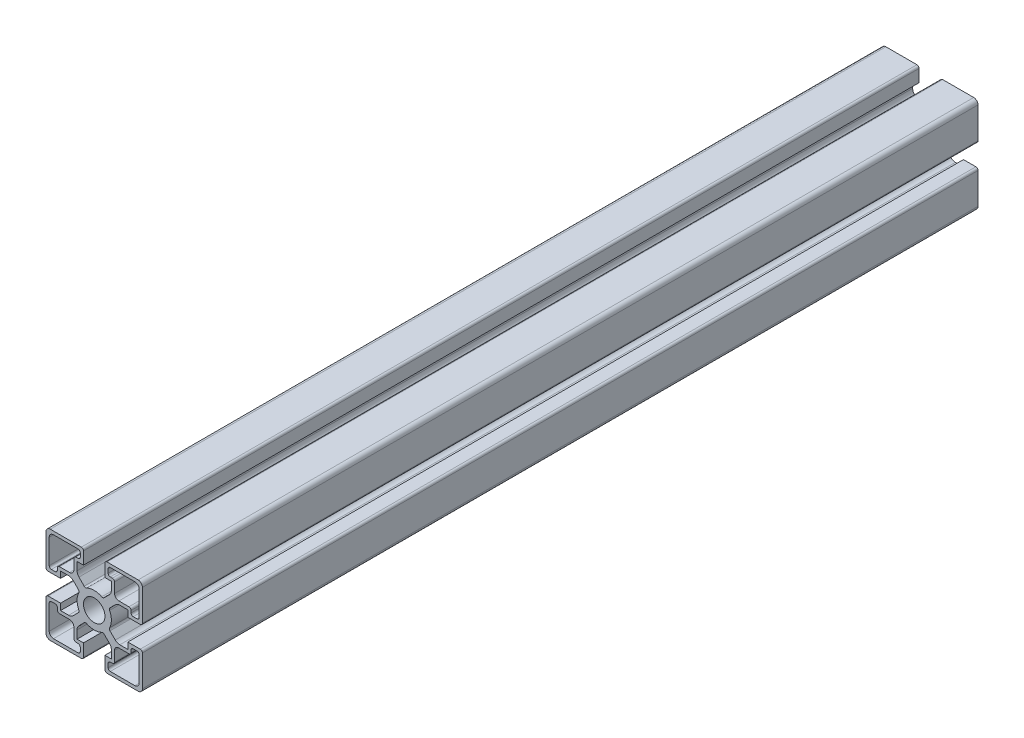
from build123d import *

# Parameters (mm, degrees)
SKETCH1_R           = 5
BOSS_EXTRUDE1_DEPTH = 390


with BuildPart() as part:
    # Sketch1 → Boss-Extrude1 (new body)
    with BuildSketch(Plane.XY):
        with BuildLine():
            Line((-5, -15.705854984), (-8, -15.705854984))
            Line((-8, -15.705854984), (-8, -11.948495671))
            ThreePointArc((-8, -11.948495671), (-7.771638598, -10.800445374), (-7.121320344, -9.827175327))
            Line((-7.121320344, -9.827175327), (-4.66838954, -7.374244523))
            ThreePointArc((-4.66838954, -7.374244523), (-4.125357909, -7.094903463), (-3.52114023, -7.183423382))
            ThreePointArc((-3.52114023, -7.183423382), (0, -8), (3.52114023, -7.183423382))
            ThreePointArc((3.52114023, -7.183423382), (4.125357909, -7.094903463), (4.66838954, -7.374244523))
            Line((4.66838954, -7.374244523), (7.121320344, -9.827175327))
            ThreePointArc((7.121320344, -9.827175327), (7.771638598, -10.800445374), (8, -11.948495671))
            Line((8, -11.948495671), (8, -15.705854984))
            Line((8, -15.705854984), (5, -15.705854984))
            Line((5, -15.705854984), (5, -21.5))
            ThreePointArc((5, -21.5), (5.292893219, -22.207106781), (6, -22.5))
            Line((6, -22.5), (20.5, -22.5))
            ThreePointArc((20.5, -22.5), (21.914213562, -21.914213562), (22.5, -20.5))
            Line((22.5, -20.5), (22.5, -6))
            ThreePointArc((22.5, -6), (22.207106781, -5.292893219), (21.5, -5))
            Line((21.5, -5), (15.705854984, -5))
            Line((15.705854984, -5), (15.705854984, -8))
            Line((15.705854984, -8), (11.948495671, -8))
            ThreePointArc((11.948495671, -8), (10.800445374, -7.771638598), (9.827175327, -7.121320344))
            Line((9.827175327, -7.121320344), (7.374244523, -4.66838954))
            ThreePointArc((7.374244523, -4.66838954), (7.094903463, -4.125357909), (7.183423382, -3.52114023))
            ThreePointArc((7.183423382, -3.52114023), (8, 0), (7.183423382, 3.52114023))
            ThreePointArc((7.183423382, 3.52114023), (7.094903463, 4.125357909), (7.374244523, 4.66838954))
            Line((7.374244523, 4.66838954), (9.827175327, 7.121320344))
            ThreePointArc((9.827175327, 7.121320344), (10.800445374, 7.771638598), (11.948495671, 8))
            Line((11.948495671, 8), (15.705854984, 8))
            Line((15.705854984, 8), (15.705854984, 5))
            Line((15.705854984, 5), (21.5, 5))
            ThreePointArc((21.5, 5), (22.207106781, 5.292893219), (22.5, 6))
            Line((22.5, 6), (22.5, 20.5))
            ThreePointArc((22.5, 20.5), (21.914213562, 21.914213562), (20.5, 22.5))
            Line((20.5, 22.5), (6, 22.5))
            ThreePointArc((6, 22.5), (5.292893219, 22.207106781), (5, 21.5))
            Line((5, 21.5), (5, 15.705854984))
            Line((5, 15.705854984), (8, 15.705854984))
            Line((8, 15.705854984), (8, 11.948495671))
            ThreePointArc((8, 11.948495671), (7.771638598, 10.800445374), (7.121320344, 9.827175327))
            Line((7.121320344, 9.827175327), (4.66838954, 7.374244523))
            ThreePointArc((4.66838954, 7.374244523), (4.125357909, 7.094903463), (3.52114023, 7.183423382))
            ThreePointArc((3.52114023, 7.183423382), (0, 8), (-3.52114023, 7.183423382))
            ThreePointArc((-3.52114023, 7.183423382), (-4.125357909, 7.094903463), (-4.66838954, 7.374244523))
            Line((-4.66838954, 7.374244523), (-7.121320344, 9.827175327))
            ThreePointArc((-7.121320344, 9.827175327), (-7.771638598, 10.800445374), (-8, 11.948495671))
            Line((-8, 11.948495671), (-8, 15.705854984))
            Line((-8, 15.705854984), (-5, 15.705854984))
            Line((-5, 15.705854984), (-5, 21.5))
            ThreePointArc((-5, 21.5), (-5.292893219, 22.207106781), (-6, 22.5))
            Line((-6, 22.5), (-20.5, 22.5))
            ThreePointArc((-20.5, 22.5), (-21.914213562, 21.914213562), (-22.5, 20.5))
            Line((-22.5, 20.5), (-22.5, 6))
            ThreePointArc((-22.5, 6), (-22.207106781, 5.292893219), (-21.5, 5))
            Line((-21.5, 5), (-15.705854984, 5))
            Line((-15.705854984, 5), (-15.705854984, 8))
            Line((-15.705854984, 8), (-11.948495671, 8))
            ThreePointArc((-11.948495671, 8), (-10.800445374, 7.771638598), (-9.827175327, 7.121320344))
            Line((-9.827175327, 7.121320344), (-7.374244523, 4.66838954))
            ThreePointArc((-7.374244523, 4.66838954), (-7.094903463, 4.125357909), (-7.183423382, 3.52114023))
            ThreePointArc((-7.183423382, 3.52114023), (-8, 0), (-7.183423382, -3.52114023))
            ThreePointArc((-7.183423382, -3.52114023), (-7.094903463, -4.125357909), (-7.374244523, -4.66838954))
            Line((-7.374244523, -4.66838954), (-9.827175327, -7.121320344))
            ThreePointArc((-9.827175327, -7.121320344), (-10.800445374, -7.771638598), (-11.948495671, -8))
            Line((-11.948495671, -8), (-15.705854984, -8))
            Line((-15.705854984, -8), (-15.705854984, -5))
            Line((-15.705854984, -5), (-21.5, -5))
            ThreePointArc((-21.5, -5), (-22.207106781, -5.292893219), (-22.5, -6))
            Line((-22.5, -6), (-22.5, -20.5))
            ThreePointArc((-22.5, -20.5), (-21.914213562, -21.914213562), (-20.5, -22.5))
            Line((-20.5, -22.5), (-6, -22.5))
            ThreePointArc((-6, -22.5), (-5.292893219, -22.207106781), (-5, -21.5))
            Line((-5, -21.5), (-5, -15.705854984))
        make_face()
        Circle(SKETCH1_R, mode=Mode.SUBTRACT)
        with BuildLine():
            Line((-19, -21), (-7.5, -21))
            ThreePointArc((-7.5, -21), (-6.792893219, -20.707106781), (-6.5, -20))
            Line((-6.5, -20), (-6.5, -18.205854984))
            ThreePointArc((-6.5, -18.205854984), (-6.792893219, -17.498748202), (-7.5, -17.205854984))
            Line((-7.5, -17.205854984), (-8.5, -17.205854984))
            ThreePointArc((-8.5, -17.205854984), (-9.207106781, -16.912961765), (-9.5, -16.205854984))
            Line((-9.5, -16.205854984), (-9.5, -11.5))
            ThreePointArc((-9.5, -11.5), (-10.085786438, -10.085786438), (-11.5, -9.5))
            Line((-11.5, -9.5), (-16.205854984, -9.5))
            ThreePointArc((-16.205854984, -9.5), (-16.912961765, -9.207106781), (-17.205854984, -8.5))
            Line((-17.205854984, -8.5), (-17.205854984, -7.5))
            ThreePointArc((-17.205854984, -7.5), (-17.498748202, -6.792893219), (-18.205854984, -6.5))
            Line((-18.205854984, -6.5), (-20, -6.5))
            ThreePointArc((-20, -6.5), (-20.707106781, -6.792893219), (-21, -7.5))
            Line((-21, -7.5), (-21, -19))
            ThreePointArc((-21, -19), (-20.414213562, -20.414213562), (-19, -21))
        make_face(mode=Mode.SUBTRACT)
        with BuildLine():
            Line((-9.5, 16.205854984), (-9.5, 11.5))
            ThreePointArc((-9.5, 11.5), (-10.085786438, 10.085786438), (-11.5, 9.5))
            Line((-11.5, 9.5), (-16.205854984, 9.5))
            ThreePointArc((-16.205854984, 9.5), (-16.912961765, 9.207106781), (-17.205854984, 8.5))
            Line((-17.205854984, 8.5), (-17.205854984, 7.5))
            ThreePointArc((-17.205854984, 7.5), (-17.498748202, 6.792893219), (-18.205854984, 6.5))
            Line((-18.205854984, 6.5), (-20, 6.5))
            ThreePointArc((-20, 6.5), (-20.707106781, 6.792893219), (-21, 7.5))
            Line((-21, 7.5), (-21, 19))
            ThreePointArc((-21, 19), (-20.414213562, 20.414213562), (-19, 21))
            Line((-19, 21), (-7.5, 21))
            ThreePointArc((-7.5, 21), (-6.792893219, 20.707106781), (-6.5, 20))
            Line((-6.5, 20), (-6.5, 18.205854984))
            ThreePointArc((-6.5, 18.205854984), (-6.792893219, 17.498748202), (-7.5, 17.205854984))
            Line((-7.5, 17.205854984), (-8.5, 17.205854984))
            ThreePointArc((-8.5, 17.205854984), (-9.207106781, 16.912961765), (-9.5, 16.205854984))
        make_face(mode=Mode.SUBTRACT)
        with BuildLine():
            Line((16.205854984, 9.5), (11.5, 9.5))
            ThreePointArc((11.5, 9.5), (10.085786438, 10.085786438), (9.5, 11.5))
            Line((9.5, 11.5), (9.5, 16.205854984))
            ThreePointArc((9.5, 16.205854984), (9.207106781, 16.912961765), (8.5, 17.205854984))
            Line((8.5, 17.205854984), (7.5, 17.205854984))
            ThreePointArc((7.5, 17.205854984), (6.792893219, 17.498748202), (6.5, 18.205854984))
            Line((6.5, 18.205854984), (6.5, 20))
            ThreePointArc((6.5, 20), (6.792893219, 20.707106781), (7.5, 21))
            Line((7.5, 21), (19, 21))
            ThreePointArc((19, 21), (20.414213562, 20.414213562), (21, 19))
            Line((21, 19), (21, 7.5))
            ThreePointArc((21, 7.5), (20.707106781, 6.792893219), (20, 6.5))
            Line((20, 6.5), (18.205854984, 6.5))
            ThreePointArc((18.205854984, 6.5), (17.498748202, 6.792893219), (17.205854984, 7.5))
            Line((17.205854984, 7.5), (17.205854984, 8.5))
            ThreePointArc((17.205854984, 8.5), (16.912961765, 9.207106781), (16.205854984, 9.5))
        make_face(mode=Mode.SUBTRACT)
        with BuildLine():
            Line((9.5, -16.205854984), (9.5, -11.5))
            ThreePointArc((9.5, -11.5), (10.085786438, -10.085786438), (11.5, -9.5))
            Line((11.5, -9.5), (16.205854984, -9.5))
            ThreePointArc((16.205854984, -9.5), (16.912961765, -9.207106781), (17.205854984, -8.5))
            Line((17.205854984, -8.5), (17.205854984, -7.5))
            ThreePointArc((17.205854984, -7.5), (17.498748202, -6.792893219), (18.205854984, -6.5))
            Line((18.205854984, -6.5), (20, -6.5))
            ThreePointArc((20, -6.5), (20.707106781, -6.792893219), (21, -7.5))
            Line((21, -7.5), (21, -19))
            ThreePointArc((21, -19), (20.414213562, -20.414213562), (19, -21))
            Line((19, -21), (7.5, -21))
            ThreePointArc((7.5, -21), (6.792893219, -20.707106781), (6.5, -20))
            Line((6.5, -20), (6.5, -18.205854984))
            ThreePointArc((6.5, -18.205854984), (6.792893219, -17.498748202), (7.5, -17.205854984))
            Line((7.5, -17.205854984), (8.5, -17.205854984))
            ThreePointArc((8.5, -17.205854984), (9.207106781, -16.912961765), (9.5, -16.205854984))
        make_face(mode=Mode.SUBTRACT)
    extrude(amount=BOSS_EXTRUDE1_DEPTH)


solid = part.part
